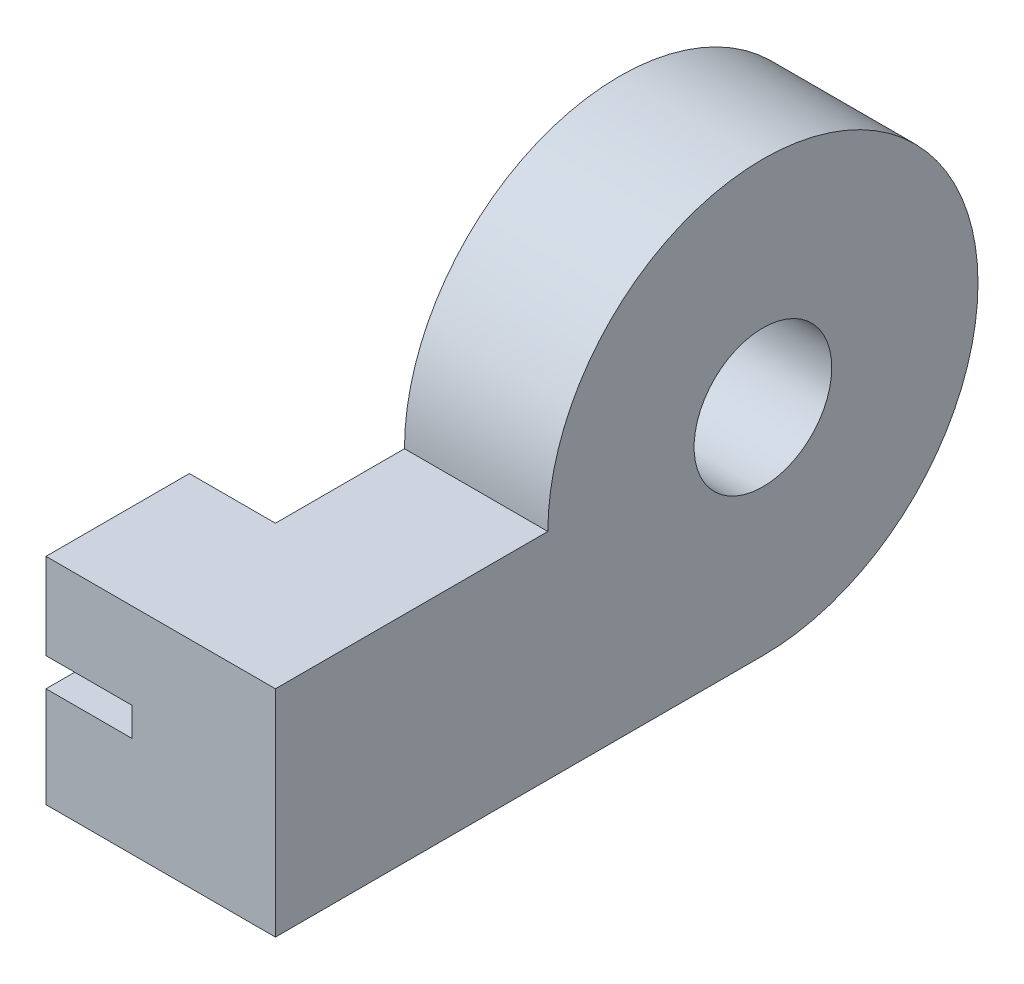
from build123d import *

# Parameters (mm, degrees)
SKETCH1_R           = 3.048
BOSS_EXTRUDE1_DEPTH = 6.35
SKETCH2_W           = 6.35
SKETCH2_H           = 3.81
SKETCH2_H_2         = 4.445
BOSS_EXTRUDE2_DEPTH = 3.81


with BuildPart() as part:
    # Sketch1 → Boss-Extrude1 (new body)
    with BuildSketch(Plane(origin=(0, 0, 0), x_dir=(0, 0, -1), z_dir=(1, 0, 0))):
        with BuildLine():
            ThreePointArc((0, -9.525), (6.735192091, 6.735192091), (-9.525, 0))
            Line((-9.525, 0), (-21.59, 0))
            Line((-21.59, 0), (-21.59, -9.525))
            Line((-21.59, -9.525), (0, -9.525))
        make_face()
        Circle(SKETCH1_R, mode=Mode.SUBTRACT)
    extrude(amount=BOSS_EXTRUDE1_DEPTH)

    # Sketch2 → Boss-Extrude2 (add)
    with BuildSketch(Plane.ZY):
        with Locations((18.415, -1.905)):
            Rectangle(SKETCH2_W, SKETCH2_H)
        with Locations((18.415, -7.3025)):
            Rectangle(SKETCH2_W, SKETCH2_H_2)
    extrude(amount=BOSS_EXTRUDE2_DEPTH)


solid = part.part
